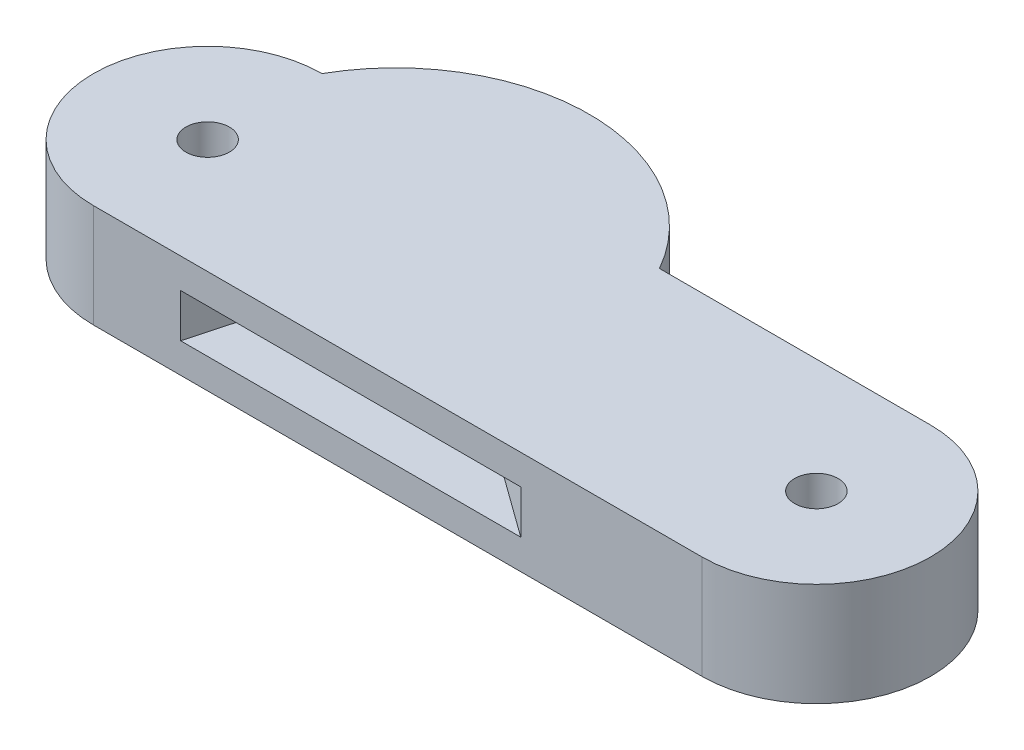
from build123d import *

# Parameters (mm, degrees)
SKETCH1_R                       = 2
BOSS_EXTRUDE1_DEPTH             = 4.75
CUT_EXTRUDE1_DEPTH              = 2
BOSS_EXTRUDE2_REACH             = 69.423
BOSS_EXTRUDE2_DIRECTION_2_REACH = 69.423
CUT_EXTRUDE2_DEPTH              = 2


with BuildPart() as part:
    # Sketch1 → Boss-Extrude1 (new, symmetric)
    with BuildSketch(Plane(origin=(0, 0, 0), x_dir=(1, 0, 0), z_dir=(0, 1, 0))):
        with BuildLine():
            Line((0, -10.500399217), (-55.93053828, -10.500399217))
            ThreePointArc((-55.93053828, -10.500399217), (-66.430937497, 0), (-55.93053828, 10.500399217))
            Line((-55.93053828, 10.500399217), (0, 10.500399217))
            ThreePointArc((0, 10.500399217), (10.500399217, 0), (0, -10.500399217))
        make_face()
        with Locations(Location((0, 0, 0), (0, 0, 270))):
            Circle(SKETCH1_R, mode=Mode.SUBTRACT)
        with Locations(Location((-55.93053828, 0, 0), (0, 0, 270))):
            Circle(SKETCH1_R, mode=Mode.SUBTRACT)
    extrude(amount=BOSS_EXTRUDE1_DEPTH, both=True)

    # Sketch3 → Cut-Extrude1 (cut, symmetric)
    with BuildSketch(Plane(origin=(0, 0, 0), x_dir=(1, 0, 0), z_dir=(0, 1, 0))):
        with BuildLine():
            Line((-35.751827911, 18.875253657), (-39.299525946, 5.868950542))
            Line((-39.299525946, 5.868950542), (26.645239155, -41.810424095))
            ThreePointArc((26.645239155, -41.810424095), (-18.563858299, -45.972421055), (-48.206523525, -11.584965354))
            Line((-48.206523525, -11.584965354), (-43.887265107, 4.249974277))
            Line((-43.887265107, 4.249974277), (-54.812276631, 12.148974547))
            ThreePointArc((-54.812276631, 12.148974547), (-46.585078234, 19.204535889), (-35.751827911, 18.875253657))
        make_face()
    extrude(amount=CUT_EXTRUDE1_DEPTH, both=True, mode=Mode.SUBTRACT)

    # Boss-Extrude2: up to this face of the body (flat: up to its plane)
    boss_extrude2_end = Plane(part.part.faces().sort_by_distance((-27.96526914, 4.75, 0))[0])
    # Sketch5 → Boss-Extrude2 (add, up to the picked face)
    with BuildSketch(Plane(origin=(0, 0, 0), x_dir=(1, 0, 0), z_dir=(0, 1, 0)), mode=Mode.PRIVATE) as boss_extrude2_sk1:
        with BuildLine():
            ThreePointArc((-24.917700351, 10.500399217), (-40.424119316, 19.553005923), (-55.93053828, 10.500399217))
            Line((-55.93053828, 10.500399217), (-24.917700351, 10.500399217))
        make_face()
    boss_extrude2_tool1 = split(extrude(boss_extrude2_sk1.sketch, amount=BOSS_EXTRUDE2_REACH, mode=Mode.PRIVATE), bisect_by=boss_extrude2_end, keep=Keep.BOTH, mode=Mode.PRIVATE)
    add(boss_extrude2_tool1.solids().sort_by(Axis((-40.424119, 0, -14.214125), (0, 1, 0)))[0])

    # Boss-Extrude2 direction 2: up to this face of the body (flat: up to its plane)
    boss_extrude2_direction_2_end = Plane(part.part.faces().sort_by_distance((-27.96526914, -4.75, 0))[0])
    # Sketch5 → Boss-Extrude2 direction 2 (add, up to the picked face)
    with BuildSketch(Plane(origin=(0, 0, 0), x_dir=(1, 0, 0), z_dir=(0, 1, 0)), mode=Mode.PRIVATE) as boss_extrude2_direction_2_sk1:
        with BuildLine():
            ThreePointArc((-24.917700351, 10.500399217), (-40.424119316, 19.553005923), (-55.93053828, 10.500399217))
            Line((-55.93053828, 10.500399217), (-24.917700351, 10.500399217))
        make_face()
    boss_extrude2_direction_2_tool1 = split(extrude(boss_extrude2_direction_2_sk1.sketch, amount=-BOSS_EXTRUDE2_DIRECTION_2_REACH, mode=Mode.PRIVATE), bisect_by=boss_extrude2_direction_2_end, keep=Keep.BOTH, mode=Mode.PRIVATE)
    add(boss_extrude2_direction_2_tool1.solids().sort_by(Axis((-40.424119, 0, -14.214125), (0, -1, 0)))[0])

    # Sketch6 → Cut-Extrude2 (cut, symmetric)
    with BuildSketch(Plane(origin=(0, 0, 0), x_dir=(1, 0, 0), z_dir=(0, 1, 0))):
        with BuildLine():
            Line((-39.299525946, 5.868950542), (-16.659276721, -10.500399217))
            Line((-16.659276721, -10.500399217), (-47.910689027, -10.500399217))
            Line((-47.910689027, -10.500399217), (-43.887265107, 4.249974277))
            Line((-43.887265107, 4.249974277), (-54.854382526, 12.179417945))
            ThreePointArc((-54.854382526, 12.179417945), (-46.349897212, 18.538096729), (-35.738154791, 18.925381021))
            Line((-35.738154791, 18.925381021), (-39.299525946, 5.868950542))
        make_face()
    extrude(amount=CUT_EXTRUDE2_DEPTH, both=True, mode=Mode.SUBTRACT)


solid = part.part
